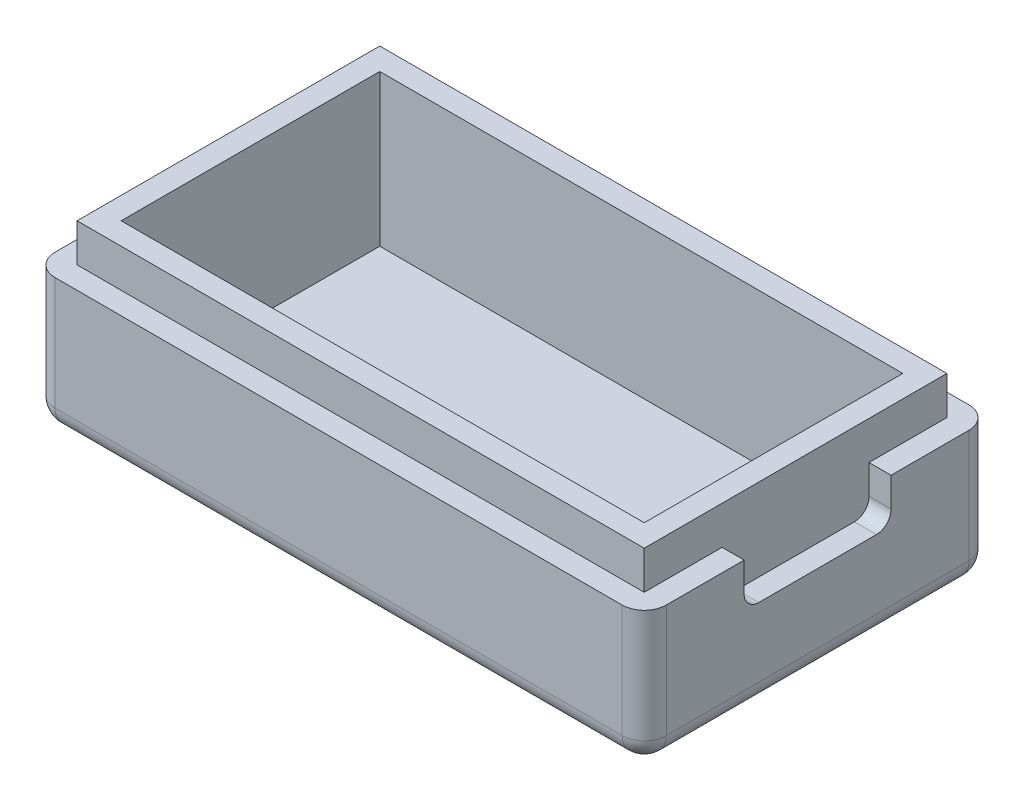
from build123d import *

# Parameters (mm, degrees)
SKETCH1_W           = 41.6
SKETCH1_H           = 23.6
BOSS_EXTRUDE1_DEPTH = 11.8
SKETCH2_W           = 35.6
SKETCH2_H           = 17.6
CUT_EXTRUDE1_DEPTH  = 10.3
SKETCH4_W           = 41.6
SKETCH4_H           = 23.6
SKETCH4_W_2         = 38.6
SKETCH4_H_2         = 20.6
CUT_EXTRUDE2_DEPTH  = 2.6
FILLET1_R           = 1.5
CUT_EXTRUDE5_DEPTH  = 1.5
CUT_EXTRUDE6_START  = -1.5
CUT_EXTRUDE6_DEPTH  = 1.5


with BuildPart() as part:
    # Sketch1 → Boss-Extrude1 (new body)
    with BuildSketch(Plane(origin=(0, 0, 0), x_dir=(1, 0, 0), z_dir=(0, 1, 0))):
        with Locations((20.8, 11.8)):
            Rectangle(SKETCH1_W, SKETCH1_H)
    extrude(amount=BOSS_EXTRUDE1_DEPTH)

    # Sketch2 → Cut-Extrude1 (cut)
    with BuildSketch(Plane(origin=(0, 11.8, 0), x_dir=(1, 0, 0), z_dir=(0, 1, 0))):
        with Locations((20.8, 11.8)):
            Rectangle(SKETCH2_W, SKETCH2_H)
    extrude(amount=-CUT_EXTRUDE1_DEPTH, mode=Mode.SUBTRACT)

    # Sketch4 → Cut-Extrude2 (cut)
    with BuildSketch(Plane(origin=(0, 11.8, 0), x_dir=(1, 0, 0), z_dir=(0, 1, 0))):
        with Locations((20.8, 11.8)):
            Rectangle(SKETCH4_W, SKETCH4_H)
        with Locations((20.8, 11.8)):
            Rectangle(SKETCH4_W_2, SKETCH4_H_2, mode=Mode.SUBTRACT)
    extrude(amount=-CUT_EXTRUDE2_DEPTH, mode=Mode.SUBTRACT)

    # Fillet1
    fillet1_edges = [part.edges().sort_by_distance(p)[0] for p in [
        (0, 4.6, -23.6),
        (41.6, 4.6, -23.6),
        (41.6, 4.6, 0),
        (0, 4.6, 0),
        (20.8, 0, -23.6),
        (41.6, 0, -11.8),
        (20.8, 0, 0),
        (0, 0, -11.8),
    ]]
    fillet(fillet1_edges, radius=FILLET1_R)

    # Sketch7 → Cut-Extrude5 (cut)
    with BuildSketch(Plane.ZY):
        with BuildLine():
            Line((-16.8, 9.2), (-6.8, 9.2))
            Line((-6.8, 9.2), (-6.8, 7.2))
            ThreePointArc((-6.8, 7.2), (-7.092893219, 6.492893219), (-7.8, 6.2))
            Line((-7.8, 6.2), (-15.8, 6.2))
            ThreePointArc((-15.8, 6.2), (-16.507106781, 6.492893219), (-16.8, 7.2))
            Line((-16.8, 7.2), (-16.8, 9.2))
        make_face()
    extrude(amount=-CUT_EXTRUDE5_DEPTH, mode=Mode.SUBTRACT)

    # Sketch8 → Cut-Extrude6 (cut)
    with BuildSketch(Plane(origin=(41.6, 0, 0), x_dir=(0, 0, -1), z_dir=(1, 0, 0)).offset(CUT_EXTRUDE6_START)):
        with BuildLine():
            Line((6.8, 9.2), (16.8, 9.2))
            Line((16.8, 9.2), (16.8, 7.2))
            ThreePointArc((16.8, 7.2), (16.507106781, 6.492893219), (15.8, 6.2))
            Line((15.8, 6.2), (7.8, 6.2))
            ThreePointArc((7.8, 6.2), (7.092893219, 6.492893219), (6.8, 7.2))
            Line((6.8, 7.2), (6.8, 9.2))
        make_face()
    extrude(amount=CUT_EXTRUDE6_DEPTH, mode=Mode.SUBTRACT)


solid = part.part
